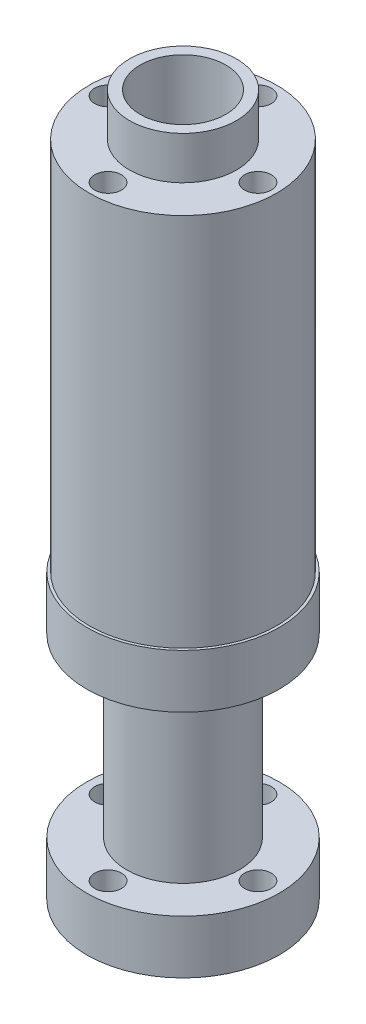
from build123d import *

# Parameters (mm, degrees)
SKETCH_1_R             = 9
SKETCH_1_R_2           = 4
EXTRUDE_1_DEPTH        = 5
HOLE_WIZARD_M3_1_D     = 2.5
SKETCH_6_R             = 5.25
EXTRUDE_2_DEPTH        = 16.5
SKETCH_7_R             = 9
EXTRUDE_3_DEPTH        = 5
SKETCH_8_R             = 8.75
EXTRUDE_4_DEPTH        = 35
HOLE_WIZARD_M3_2_D     = 2.5
HOLE_WIZARD_M3_2_DEPTH = 10
HOLE_WIZARD_M3_2_TIP   = 0.751075774
SKETCH_12_R            = 5
EXTRUDE_5_DEPTH        = 4
SKETCH_13_R            = 4
CUT_EXTRUDE_1_DEPTH    = 165
EXTRUDE_START          = 2
SKETCH_14_R            = 5
SKETCH_14_R_2          = 4
EXTRUDE_6_DEPTH        = 2
FILLET_1_R             = 2


with BuildPart() as part:
    # 草图1 → 凸台-拉伸1 (new body)
    with BuildSketch(Plane(origin=(0, 0, 0), x_dir=(1, 0, 0), z_dir=(0, 1, 0))):
        with Locations(Location((0, 0, 0), (0, 0, 270))):
            Circle(SKETCH_1_R)
        with Locations(Location((0, 0, 0), (0, 0, 270))):
            Circle(SKETCH_1_R_2, mode=Mode.SUBTRACT)
    extrude(amount=EXTRUDE_1_DEPTH)

    # M3 螺纹孔1 (through all)
    with Locations(Plane(origin=(0, 0, 0), x_dir=(-1, 0, 0), z_dir=(0, -1, 0))):
        with Locations((7, 0), (0, -7), (-7, 0), (0, 7)):
            Hole(HOLE_WIZARD_M3_1_D / 2)

    # 草图6 → 凸台-拉伸2 (add)
    with BuildSketch(Plane(origin=(0, 5, 0), x_dir=(1, 0, 0), z_dir=(0, 1, 0))):
        with Locations(Location((0, 0, 0), (0, 0, 270))):
            Circle(SKETCH_6_R)
    extrude(amount=EXTRUDE_2_DEPTH)

    # 草图7 → 凸台-拉伸3 (add)
    with BuildSketch(Plane(origin=(0, 21.5, 0), x_dir=(1, 0, 0), z_dir=(0, 1, 0))):
        with Locations(Location((0, 0, 0), (0, 0, 270))):
            Circle(SKETCH_7_R)
    extrude(amount=EXTRUDE_3_DEPTH)

    # 草图8 → 凸台-拉伸4 (add)
    with BuildSketch(Plane(origin=(0, 26.5, 0), x_dir=(1, 0, 0), z_dir=(0, 1, 0))):
        with Locations(Location((0, 0, 0), (0, 0, 270))):
            Circle(SKETCH_8_R)
    extrude(amount=EXTRUDE_4_DEPTH)

    # M3 螺纹孔2
    with Locations(Plane(origin=(0, 61.5, 0), x_dir=(1, 0, 0), z_dir=(0, 1, 0))):
        with Locations((0, 7), (-7, 0), (7, 0), (0, -7)):
            Hole(HOLE_WIZARD_M3_2_D / 2, depth=HOLE_WIZARD_M3_2_DEPTH)
            with Locations((0, 0, -(HOLE_WIZARD_M3_2_DEPTH + HOLE_WIZARD_M3_2_TIP / 2))):  # 118° drill point
                Cone(0, HOLE_WIZARD_M3_2_D / 2, HOLE_WIZARD_M3_2_TIP, mode=Mode.SUBTRACT)

    # 草图12 → 凸台-拉伸5 (add)
    with BuildSketch(Plane(origin=(0, 61.5, 0), x_dir=(1, 0, 0), z_dir=(0, 1, 0))):
        with Locations(Location((0, 0, 0), (0, 0, 270))):
            Circle(SKETCH_12_R)
    extrude(amount=EXTRUDE_5_DEPTH)

    # 草图13 → 切除-拉伸1 (cut)
    with BuildSketch(Plane.XZ.offset(-5)):
        with Locations(Location((0, 0, 0), (0, 0, 90))):
            Circle(SKETCH_13_R)
    extrude(amount=-CUT_EXTRUDE_1_DEPTH, mode=Mode.SUBTRACT)

    # 草图14 → 凸台-拉伸6 (add)
    with BuildSketch(Plane.XZ.offset(EXTRUDE_START)):
        with Locations(Location((0, 0, 0), (0, 0, 90))):
            Circle(SKETCH_14_R)
        with Locations(Location((0, 0, 0), (0, 0, 270))):
            Circle(SKETCH_14_R_2, mode=Mode.SUBTRACT)
    extrude(amount=-EXTRUDE_6_DEPTH)

    # 圆角1
    fillet_1_edges = [part.edges().sort_by_distance(p)[0] for p in [
        (0, 21.5, -5.25),
    ]]
    fillet(fillet_1_edges, radius=FILLET_1_R)


solid = part.part
